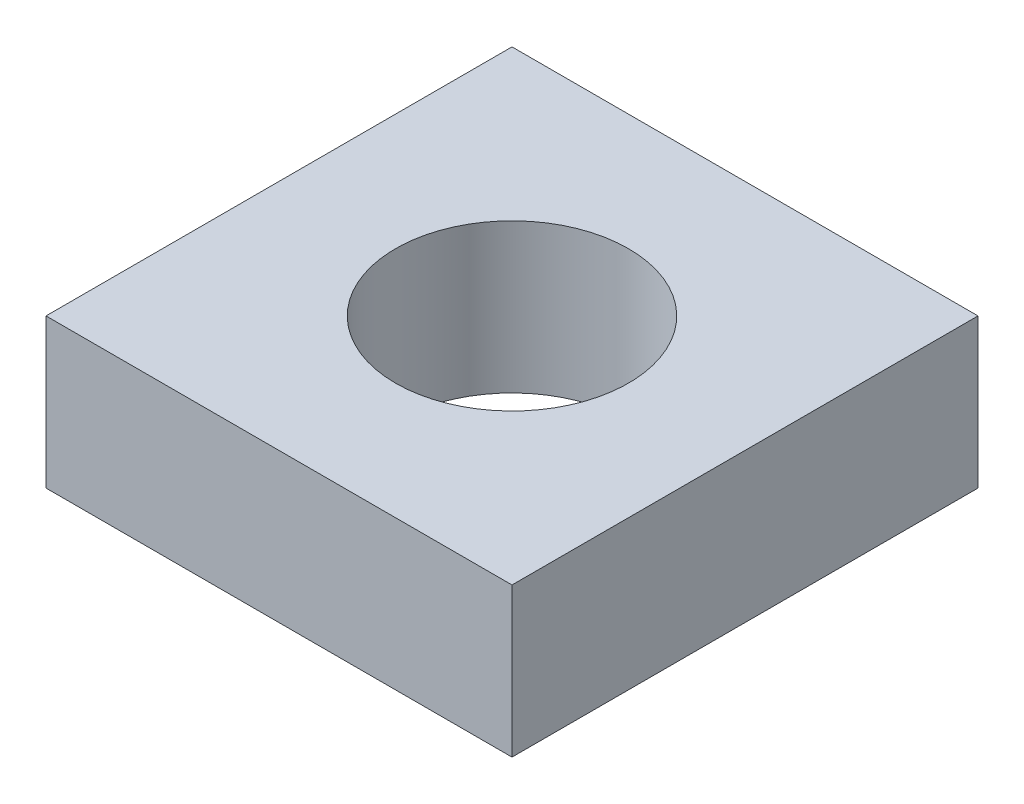
from build123d import *

# Parameters (mm, degrees)
SKICA1_W                = 5
SKICA1_H                = 5
SKICA1_R                = 1.25
P_IDAT_VYSUNUT_M1_DEPTH = 1.6


with BuildPart() as part:
    # Skica1 → Přidat vysunutím1 (new body)
    with BuildSketch(Plane(origin=(0, 0, 0), x_dir=(1, 0, 0), z_dir=(0, 1, 0))):
        Rectangle(SKICA1_W, SKICA1_H)
        with Locations(Location((0, 0, 0), (0, 0, 270))):
            Circle(SKICA1_R, mode=Mode.SUBTRACT)
    extrude(amount=P_IDAT_VYSUNUT_M1_DEPTH)


solid = part.part
